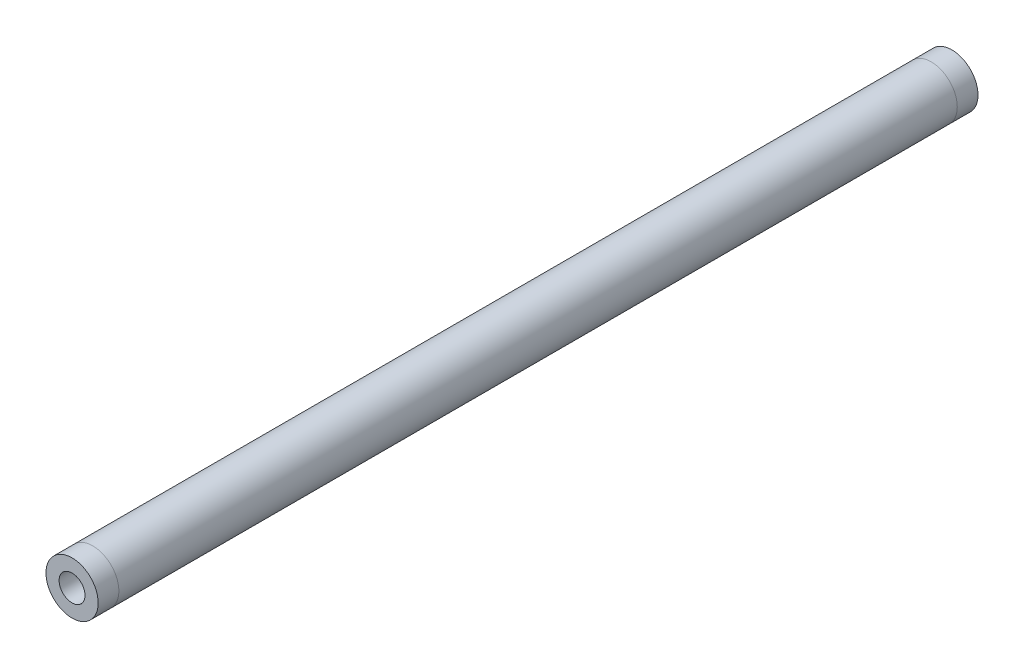
from build123d import *

# Parameters (mm, degrees)
SKETCH1_R                 = 8.001
SKETCH1_R_2               = 6.477
SKETCH1_R_3               = 3.96875
THREADED_INSERT_1_1_DEPTH = 6.35
THREADED_START            = -6.35
SKETCH1_3_R               = 6.477
SKETCH1_3_R_2             = 3.96875
THREADED_INSERT_1_2_DEPTH = 9.525
TUBE_START                = -6.35
SKETCH1_4_R               = 8.001
SKETCH1_4_R_2             = 6.477
TUBE_EXTRUDE_DEPTH        = 256.953958
THREADED_START_2          = -263.303958
SKETCH1_6_R               = 6.477
SKETCH1_6_R_2             = 3.96875
THREADED_INSERT_2_1_DEPTH = 9.525
SKETCH1_9_R               = 8.001
SKETCH1_9_R_2             = 6.477
SKETCH1_9_R_3             = 3.96875
THREADED_INSERT_2_2_DEPTH = 6.35


with BuildPart() as part:
    # Sketch1 → Threaded insert 1-1 (new body)
    # profile 1 of 2: a face of its own
    with BuildSketch(Plane.XY):
        Circle(SKETCH1_R)
        Circle(SKETCH1_R_2, mode=Mode.SUBTRACT)
    # profile 2 of 2: a face of its own
    with BuildSketch(Plane.XY):
        Circle(SKETCH1_R_2)
        Circle(SKETCH1_R_3, mode=Mode.SUBTRACT)
    extrude(amount=-THREADED_INSERT_1_1_DEPTH)

    # Sketch1<3> → Threaded insert 1-2 (add)
    with BuildSketch(Plane.XY.offset(THREADED_START)):
        Circle(SKETCH1_3_R)
        Circle(SKETCH1_3_R_2, mode=Mode.SUBTRACT)
    extrude(amount=-THREADED_INSERT_1_2_DEPTH)


with BuildPart() as body_2:
    # Sketch1<4> → Tube extrude (new body)
    with BuildSketch(Plane.XY.offset(TUBE_START)):
        Circle(SKETCH1_4_R)
        Circle(SKETCH1_4_R_2, mode=Mode.SUBTRACT)
    extrude(amount=-TUBE_EXTRUDE_DEPTH)


with BuildPart() as body_3:
    # Sketch1<6> → Threaded insert 2-1 (new body)
    with BuildSketch(Plane.XY.offset(THREADED_START_2)):
        Circle(SKETCH1_6_R)
        Circle(SKETCH1_6_R_2, mode=Mode.SUBTRACT)
    extrude(amount=THREADED_INSERT_2_1_DEPTH)


with BuildPart() as body_4:
    # Sketch1<9> → Threaded insert 2-2 (new body)
    # profile 1 of 2: a face of its own
    with BuildSketch(Plane.XY.offset(THREADED_START_2)):
        Circle(SKETCH1_9_R)
        Circle(SKETCH1_9_R_2, mode=Mode.SUBTRACT)
    # profile 2 of 2: a face of its own
    with BuildSketch(Plane.XY.offset(THREADED_START_2)):
        Circle(SKETCH1_9_R_2)
        Circle(SKETCH1_9_R_3, mode=Mode.SUBTRACT)
    extrude(amount=-THREADED_INSERT_2_2_DEPTH)

    # Combine1: union body 3
    add(body_3.part)


solid = Compound([part.part, body_2.part, body_4.part])
